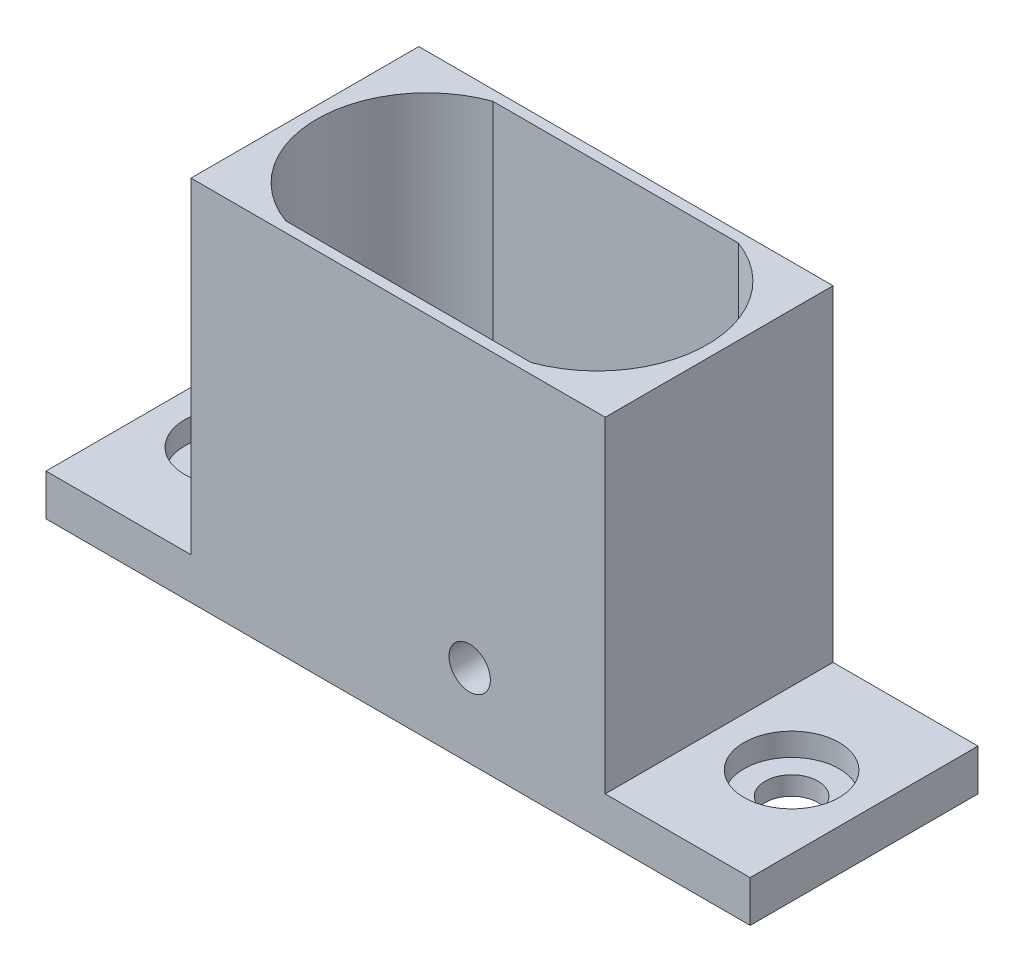
from build123d import *

# Parameters (mm, degrees)
SKETCH1_W           = 14
SKETCH1_H           = 22
SKETCH1_R           = 4.6
SKETCH1_R_2         = 2.55
SKETCH1_W_2         = 40
SKETCH1_W_3         = 12
SKETCH1_H_2         = 9.2
BOSS_EXTRUDE1_DEPTH = 17.75
CUT_EXTRUDE1_START  = -13.75
SKETCH1_5_W         = 14
SKETCH1_5_H         = 22
SKETCH1_5_R         = 4.6
SKETCH1_5_R_2       = 2.55
CUT_EXTRUDE1_DEPTH  = 31.5
CUT_EXTRUDE2_START  = -15.95
SKETCH1_6_R         = 4.6
SKETCH1_6_R_2       = 2.55
CUT_EXTRUDE2_DEPTH  = 2.2
CUT_EXTRUDE3_START  = 17.75
SKETCH1_7_W         = 12
SKETCH1_7_H         = 9.2
CUT_EXTRUDE3_DEPTH  = 23
CUT_EXTRUDE4_START  = -5.25
SKETCH1_8_W         = 12
SKETCH1_8_H         = 9.2
CUT_EXTRUDE4_DEPTH  = 9
CUT_EXTRUDE5_REACH  = 46.216
SKETCH2_R           = 2
SKETCH2_3_R         = 4.125
CUT_EXTRUDE6_DEPTH  = 2.5


with BuildPart() as part:
    # Sketch1 → Boss-Extrude1 (new, symmetric)
    # profile 1 of 7: a face of its own
    with BuildSketch(Plane(origin=(0, 0, 0), x_dir=(1, 0, 0), z_dir=(0, 1, 0))):
        with Locations((-27, 0)):
            Rectangle(SKETCH1_W, SKETCH1_H)
        with Locations((-27, 0)):
            Circle(SKETCH1_R, mode=Mode.SUBTRACT)
    # profile 2 of 7: a face of its own
    with BuildSketch(Plane(origin=(0, 0, 0), x_dir=(1, 0, 0), z_dir=(0, 1, 0))):
        with Locations((-27, 0)):
            Circle(SKETCH1_R)
        with Locations(Location((-27, 0, 0), (0, 0, 270))):
            Circle(SKETCH1_R_2, mode=Mode.SUBTRACT)
    # profile 3 of 7: a face of its own
    with BuildSketch(Plane(origin=(0, 0, 0), x_dir=(1, 0, 0), z_dir=(0, 1, 0))):
        Rectangle(SKETCH1_W_2, SKETCH1_H)
        with BuildLine():
            Line((11.854501341, -10), (-11.854501341, -10))
            ThreePointArc((-11.854501341, -10), (-18.86, 0), (-11.854501341, 10))
            Line((-11.854501341, 10), (11.854501341, 10))
            ThreePointArc((11.854501341, 10), (18.86, 0), (11.854501341, -10))
        make_face(mode=Mode.SUBTRACT)
    # profile 4 of 7: a face of its own
    with BuildSketch(Plane(origin=(0, 0, 0), x_dir=(1, 0, 0), z_dir=(0, 1, 0))):
        with BuildLine():
            ThreePointArc((11.854501341, 10), (18.86, 0), (11.854501341, -10))
            Line((11.854501341, -10), (-11.854501341, -10))
            ThreePointArc((-11.854501341, -10), (-18.86, 0), (-11.854501341, 10))
            Line((-11.854501341, 10), (11.854501341, 10))
        make_face()
        with Locations((6.92918915, 0)):
            Rectangle(SKETCH1_W_3, SKETCH1_H_2, mode=Mode.SUBTRACT)
    # profile 5 of 7: a face of its own
    with BuildSketch(Plane(origin=(0, 0, 0), x_dir=(1, 0, 0), z_dir=(0, 1, 0))):
        with Locations((6.92918915, 0)):
            Rectangle(SKETCH1_W_3, SKETCH1_H_2)
    # profile 6 of 7: a face of its own
    with BuildSketch(Plane(origin=(0, 0, 0), x_dir=(1, 0, 0), z_dir=(0, 1, 0))):
        with Locations((27, 0)):
            Rectangle(SKETCH1_W, SKETCH1_H)
        with Locations((27, 0)):
            Circle(SKETCH1_R, mode=Mode.SUBTRACT)
    # profile 7 of 7: a face of its own
    with BuildSketch(Plane(origin=(0, 0, 0), x_dir=(1, 0, 0), z_dir=(0, 1, 0))):
        with Locations((27, 0)):
            Circle(SKETCH1_R)
        with Locations(Location((27, 0, 0), (0, 0, 270))):
            Circle(SKETCH1_R_2, mode=Mode.SUBTRACT)
    extrude(amount=BOSS_EXTRUDE1_DEPTH, both=True)

    # Sketch1<5> → Cut-Extrude1 (cut)
    # profile 1 of 4: a face of its own
    with BuildSketch(Plane(origin=(0, 0, 0), x_dir=(1, 0, 0), z_dir=(0, 1, 0)).offset(CUT_EXTRUDE1_START)):
        with Locations((-27, 0)):
            Rectangle(SKETCH1_5_W, SKETCH1_5_H)
        with Locations((-27, 0)):
            Circle(SKETCH1_5_R, mode=Mode.SUBTRACT)
    # profile 2 of 4: a face of its own
    with BuildSketch(Plane(origin=(0, 0, 0), x_dir=(1, 0, 0), z_dir=(0, 1, 0)).offset(CUT_EXTRUDE1_START)):
        with Locations((27, 0)):
            Rectangle(SKETCH1_5_W, SKETCH1_5_H)
        with Locations((27, 0)):
            Circle(SKETCH1_5_R, mode=Mode.SUBTRACT)
    # profile 3 of 4: a face of its own
    with BuildSketch(Plane(origin=(0, 0, 0), x_dir=(1, 0, 0), z_dir=(0, 1, 0)).offset(CUT_EXTRUDE1_START)):
        with Locations((-27, 0)):
            Circle(SKETCH1_5_R)
        with Locations(Location((-27, 0, 0), (0, 0, 270))):
            Circle(SKETCH1_5_R_2, mode=Mode.SUBTRACT)
    # profile 4 of 4: a face of its own
    with BuildSketch(Plane(origin=(0, 0, 0), x_dir=(1, 0, 0), z_dir=(0, 1, 0)).offset(CUT_EXTRUDE1_START)):
        with Locations((27, 0)):
            Circle(SKETCH1_5_R)
        with Locations(Location((27, 0, 0), (0, 0, 270))):
            Circle(SKETCH1_5_R_2, mode=Mode.SUBTRACT)
    extrude(amount=CUT_EXTRUDE1_DEPTH, mode=Mode.SUBTRACT)

    # Sketch1<6> → Cut-Extrude2 (cut)
    # profile 1 of 2: a face of its own
    with BuildSketch(Plane(origin=(0, 0, 0), x_dir=(1, 0, 0), z_dir=(0, 1, 0)).offset(CUT_EXTRUDE2_START)):
        with Locations(Location((-27, 0, 0), (0, 0, 270))):
            Circle(SKETCH1_6_R)
        with Locations(Location((-27, 0, 0), (0, 0, 270))):
            Circle(SKETCH1_6_R_2, mode=Mode.SUBTRACT)
    # profile 2 of 2: a face of its own
    with BuildSketch(Plane(origin=(0, 0, 0), x_dir=(1, 0, 0), z_dir=(0, 1, 0)).offset(CUT_EXTRUDE2_START)):
        with Locations(Location((27, 0, 0), (0, 0, 270))):
            Circle(SKETCH1_6_R)
        with Locations(Location((27, 0, 0), (0, 0, 270))):
            Circle(SKETCH1_6_R_2, mode=Mode.SUBTRACT)
    extrude(amount=CUT_EXTRUDE2_DEPTH, mode=Mode.SUBTRACT)

    # Sketch1<7> → Cut-Extrude3 (cut)
    # profile 1 of 2: a face of its own
    with BuildSketch(Plane(origin=(0, 0, 0), x_dir=(1, 0, 0), z_dir=(0, 1, 0)).offset(CUT_EXTRUDE3_START)):
        with BuildLine():
            ThreePointArc((11.854501341, 10), (18.86, 0), (11.854501341, -10))
            Line((11.854501341, -10), (-11.854501341, -10))
            ThreePointArc((-11.854501341, -10), (-18.86, 0), (-11.854501341, 10))
            Line((-11.854501341, 10), (11.854501341, 10))
        make_face()
        with Locations((6.92918915, 0)):
            Rectangle(SKETCH1_7_W, SKETCH1_7_H, mode=Mode.SUBTRACT)
    # profile 2 of 2: a face of its own
    with BuildSketch(Plane(origin=(0, 0, 0), x_dir=(1, 0, 0), z_dir=(0, 1, 0)).offset(CUT_EXTRUDE3_START)):
        with Locations((6.92918915, 0)):
            Rectangle(SKETCH1_7_W, SKETCH1_7_H)
    extrude(amount=-CUT_EXTRUDE3_DEPTH, mode=Mode.SUBTRACT)

    # Sketch1<8> → Cut-Extrude4 (cut)
    with BuildSketch(Plane(origin=(0, 0, 0), x_dir=(1, 0, 0), z_dir=(0, 1, 0)).offset(CUT_EXTRUDE4_START)):
        with Locations((6.92918915, 0)):
            Rectangle(SKETCH1_8_W, SKETCH1_8_H)
    extrude(amount=-CUT_EXTRUDE4_DEPTH, mode=Mode.SUBTRACT)

    # Cut-Extrude5: up to this face of the body (flat: up to its plane)
    cut_extrude5_end = Plane(part.part.faces().sort_by_distance((0, -1.151436031, 11))[0])
    # Sketch2 → Cut-Extrude5 (cut, up to the picked face)
    with BuildSketch(Plane(origin=(0, 0, -11), x_dir=(-1, 0, 0), z_dir=(0, 0, -1)), mode=Mode.PRIVATE) as cut_extrude5_sk1:
        with Locations((-6.91, -9.77)):
            Circle(SKETCH2_R)
    cut_extrude5_tool1 = split(extrude(cut_extrude5_sk1.sketch, amount=-CUT_EXTRUDE5_REACH, mode=Mode.PRIVATE), bisect_by=cut_extrude5_end, keep=Keep.BOTH, mode=Mode.PRIVATE)
    add(cut_extrude5_tool1.solids().sort_by(Axis((6.91, -9.77, -11), (0, 0, 1)))[0], mode=Mode.SUBTRACT)

    # Sketch2<3> → Cut-Extrude6 (cut)
    with BuildSketch(Plane(origin=(0, 0, -11), x_dir=(-1, 0, 0), z_dir=(0, 0, -1))):
        with Locations((-6.91, -9.77)):
            Circle(SKETCH2_3_R)
    extrude(amount=-CUT_EXTRUDE6_DEPTH, mode=Mode.SUBTRACT)


solid = part.part
